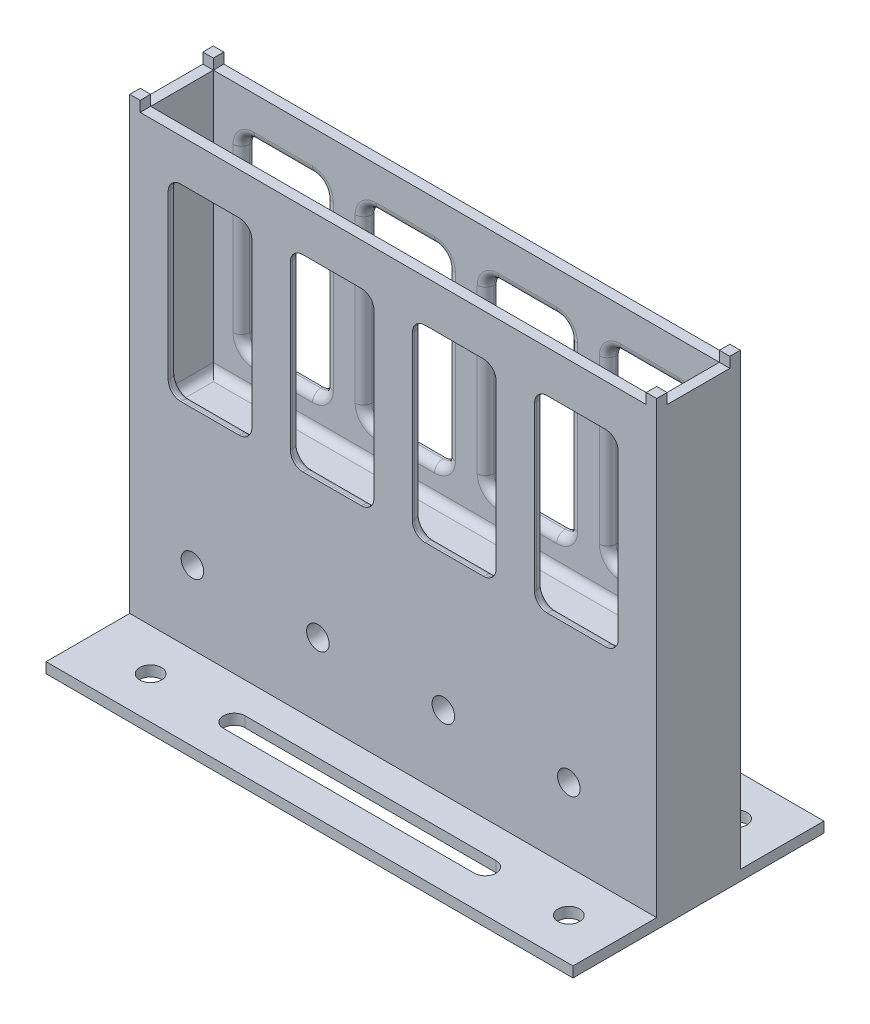
from build123d import *

# Parameters (mm, degrees)
SKETCH1_W               = 160.02
SKETCH1_H               = 25.4
BOSS_EXTRUDE1_DEPTH     = 82.55
SKETCH2_W               = 153.67
SKETCH2_H               = 19.05
CUT_EXTRUDE1_DEPTH      = 79.375
CUT_EXTRUDE2_DEPTH      = 118.733863438
SKETCH5_W               = 3.175
SKETCH5_H               = 3.175
BOSS_EXTRUDE2_DEPTH     = 3.175
SKETCH6_W               = 160.02
SKETCH6_H               = 25.4
BOSS_EXTRUDE3_DEPTH     = 50.8
SKETCH7_W               = 160.02
SKETCH7_H               = 76.2
BOSS_EXTRUDE4_DEPTH     = 3.175
SKETCH8_R               = 3.302
CUT_EXTRUDE3_DEPTH      = 163.764510029
FILLET1_R               = 2.54
CUT_EXTRUDE4_DEPTH      = 2.921
CUT_EXTRUDE5_DEPTH      = 124.296332975
CUT_EXTRUDE5_DEPTH_BACK = 124.296332975
SKETCH10_R              = 3.429
FILLET2_R               = 2.54


with BuildPart() as part:
    # Sketch1 → Boss-Extrude1 (new body)
    with BuildSketch(Plane(origin=(0, 0, 0), x_dir=(1, 0, 0), z_dir=(0, 1, 0))):
        Rectangle(SKETCH1_W, SKETCH1_H)
    extrude(amount=BOSS_EXTRUDE1_DEPTH)

    # Sketch2 → Cut-Extrude1 (cut)
    with BuildSketch(Plane(origin=(0, 82.55, 0), x_dir=(1, 0, 0), z_dir=(0, 1, 0))):
        Rectangle(SKETCH2_W, SKETCH2_H)
    extrude(amount=-CUT_EXTRUDE1_DEPTH, mode=Mode.SUBTRACT)

    # Sketch3 → Cut-Extrude2 (cut, through all)
    with BuildSketch(Plane.XY.offset(12.7)):
        with BuildLine():
            Line((-64.516, 69.85), (-46.736, 69.85))
            ThreePointArc((-46.736, 69.85), (-44.041923164, 68.734076836), (-42.926, 66.04))
            Line((-42.926, 66.04), (-42.926, 16.51))
            ThreePointArc((-42.926, 16.51), (-44.041923164, 13.815923164), (-46.736, 12.7))
            Line((-46.736, 12.7), (-64.516, 12.7))
            ThreePointArc((-64.516, 12.7), (-67.210076836, 13.815923164), (-68.326, 16.51))
            Line((-68.326, 16.51), (-68.326, 66.04))
            ThreePointArc((-68.326, 66.04), (-67.210076836, 68.734076836), (-64.516, 69.85))
        make_face()
        with BuildLine():
            Line((-27.432, 69.85), (-9.652, 69.85))
            ThreePointArc((-9.652, 69.85), (-6.957923164, 68.734076836), (-5.842, 66.04))
            Line((-5.842, 66.04), (-5.842, 16.51))
            ThreePointArc((-5.842, 16.51), (-6.957923164, 13.815923164), (-9.652, 12.7))
            Line((-9.652, 12.7), (-27.432, 12.7))
            ThreePointArc((-27.432, 12.7), (-30.126076836, 13.815923164), (-31.242, 16.51))
            Line((-31.242, 16.51), (-31.242, 66.04))
            ThreePointArc((-31.242, 66.04), (-30.126076836, 68.734076836), (-27.432, 69.85))
        make_face()
        with BuildLine():
            Line((9.652, 69.85), (27.432, 69.85))
            ThreePointArc((27.432, 69.85), (30.126076836, 68.734076836), (31.242, 66.04))
            Line((31.242, 66.04), (31.242, 16.51))
            ThreePointArc((31.242, 16.51), (30.126076836, 13.815923164), (27.432, 12.7))
            Line((27.432, 12.7), (9.652, 12.7))
            ThreePointArc((9.652, 12.7), (6.957923164, 13.815923164), (5.842, 16.51))
            Line((5.842, 16.51), (5.842, 66.04))
            ThreePointArc((5.842, 66.04), (6.957923164, 68.734076836), (9.652, 69.85))
        make_face()
        with BuildLine():
            Line((46.736, 69.85), (64.516, 69.85))
            ThreePointArc((64.516, 69.85), (67.210076836, 68.734076836), (68.326, 66.04))
            Line((68.326, 66.04), (68.326, 16.51))
            ThreePointArc((68.326, 16.51), (67.210076836, 13.815923164), (64.516, 12.7))
            Line((64.516, 12.7), (46.736, 12.7))
            ThreePointArc((46.736, 12.7), (44.041923164, 13.815923164), (42.926, 16.51))
            Line((42.926, 16.51), (42.926, 66.04))
            ThreePointArc((42.926, 66.04), (44.041923164, 68.734076836), (46.736, 69.85))
        make_face()
    extrude(amount=-CUT_EXTRUDE2_DEPTH, mode=Mode.SUBTRACT)

    # Sketch5 → Boss-Extrude2 (add)
    with BuildSketch(Plane(origin=(0, 82.55, 0), x_dir=(1, 0, 0), z_dir=(0, 1, 0))):
        with Locations((-78.4225, 11.1125)):
            Rectangle(SKETCH5_W, SKETCH5_H)
        with Locations((-78.4225, -11.1125)):
            Rectangle(SKETCH5_W, SKETCH5_H)
        with Locations((78.4225, -11.1125)):
            Rectangle(SKETCH5_W, SKETCH5_H)
        with Locations((78.4225, 11.1125)):
            Rectangle(SKETCH5_W, SKETCH5_H)
    extrude(amount=BOSS_EXTRUDE2_DEPTH)

    # Sketch6 → Boss-Extrude3 (add)
    with BuildSketch(Plane.XZ):
        Rectangle(SKETCH6_W, SKETCH6_H)
    extrude(amount=BOSS_EXTRUDE3_DEPTH)

    # Sketch7 → Boss-Extrude4 (add)
    with BuildSketch(Plane(origin=(0, -50.8, 0), x_dir=(-1, 0, 0), z_dir=(0, -1, 0))):
        Rectangle(SKETCH7_W, SKETCH7_H)
    extrude(amount=BOSS_EXTRUDE4_DEPTH)

    # Sketch8 → Cut-Extrude3 (cut, through all)
    with BuildSketch(Plane(origin=(0, -50.8, 0), x_dir=(1, 0, 0), z_dir=(0, 1, 0))):
        with Locations(Location((-60.96, 25.4, 0), (0, 0, 270))):
            Circle(SKETCH8_R)
        with Locations(Location((66.04, 25.4, 0), (0, 0, 270))):
            Circle(SKETCH8_R)
        with Locations(Location((66.04, -25.4, 0), (0, 0, 270))):
            Circle(SKETCH8_R)
        with Locations(Location((-60.96, -25.4, 0), (0, 0, 270))):
            Circle(SKETCH8_R)
        with BuildLine():
            Line((-35.56, 28.702), (40.64, 28.702))
            ThreePointArc((40.64, 28.702), (43.942, 25.4), (40.64, 22.098))
            Line((40.64, 22.098), (-35.56, 22.098))
            ThreePointArc((-35.56, 22.098), (-38.862, 25.4), (-35.56, 28.702))
        make_face()
        with BuildLine():
            Line((-35.56, -22.098), (40.64, -22.098))
            ThreePointArc((40.64, -22.098), (43.942, -25.4), (40.64, -28.702))
            Line((40.64, -28.702), (-35.56, -28.702))
            ThreePointArc((-35.56, -28.702), (-38.862, -25.4), (-35.56, -22.098))
        make_face()
    extrude(amount=-CUT_EXTRUDE3_DEPTH, mode=Mode.SUBTRACT)

    # Fillet1
    fillet1_edges = [part.edges().sort_by_distance(p)[0] for p in [
        (-6.957923164, 13.815923164, -9.525),
        (-18.542, 12.7, -9.525),
        (-30.126076836, 13.815923164, -9.525),
        (-31.242, 41.275, -9.525),
        (-30.126076836, 68.734076836, -9.525),
        (-18.542, 69.85, -9.525),
        (-6.957923164, 68.734076836, -9.525),
        (-5.842, 41.275, -9.525),
        (30.126076836, 13.815923164, -9.525),
        (18.542, 12.7, -9.525),
        (6.957923164, 13.815923164, -9.525),
        (5.842, 41.275, -9.525),
        (6.957923164, 68.734076836, -9.525),
        (18.542, 69.85, -9.525),
        (30.126076836, 68.734076836, -9.525),
        (31.242, 41.275, -9.525),
        (67.210076836, 13.815923164, -9.525),
        (55.626, 12.7, -9.525),
        (44.041923164, 13.815923164, -9.525),
        (42.926, 41.275, -9.525),
        (44.041923164, 68.734076836, -9.525),
        (55.626, 69.85, -9.525),
        (67.210076836, 68.734076836, -9.525),
        (68.326, 41.275, -9.525),
        (-42.926, 41.275, 9.525),
        (-44.041923164, 68.734076836, 9.525),
        (-55.626, 69.85, 9.525),
        (-67.210076836, 68.734076836, 9.525),
        (-68.326, 41.275, 9.525),
        (-67.210076836, 13.815923164, 9.525),
        (-55.626, 12.7, 9.525),
        (-44.041923164, 13.815923164, 9.525),
        (-44.041923164, 13.815923164, -9.525),
        (-55.626, 12.7, -9.525),
        (-67.210076836, 13.815923164, -9.525),
        (-68.326, 41.275, -9.525),
        (-67.210076836, 68.734076836, -9.525),
        (-55.626, 69.85, -9.525),
        (-44.041923164, 68.734076836, -9.525),
        (-42.926, 41.275, -9.525),
        (68.326, 41.275, 9.525),
        (67.210076836, 68.734076836, 9.525),
        (55.626, 69.85, 9.525),
        (44.041923164, 68.734076836, 9.525),
        (42.926, 41.275, 9.525),
        (44.041923164, 13.815923164, 9.525),
        (55.626, 12.7, 9.525),
        (67.210076836, 13.815923164, 9.525),
        (31.242, 41.275, 9.525),
        (30.126076836, 68.734076836, 9.525),
        (18.542, 69.85, 9.525),
        (6.957923164, 68.734076836, 9.525),
        (5.842, 41.275, 9.525),
        (6.957923164, 13.815923164, 9.525),
        (18.542, 12.7, 9.525),
        (30.126076836, 13.815923164, 9.525),
        (-5.842, 41.275, 9.525),
        (-6.957923164, 68.734076836, 9.525),
        (-18.542, 69.85, 9.525),
        (-30.126076836, 68.734076836, 9.525),
        (-31.242, 41.275, 9.525),
        (-30.126076836, 13.815923164, 9.525),
        (-18.542, 12.7, 9.525),
        (-6.957923164, 13.815923164, 9.525),
    ]]
    fillet(fillet1_edges, radius=FILLET1_R)

    # Sketch9 → Cut-Extrude4 (cut, symmetric)
    with BuildSketch(Plane.XY):
        Polygon((-66.421, -31.72790982), (-66.421, -65.540462496), (-55.499, -65.540462496), (-55.499, -31.72790982), (-55.499, -25.42209018), (-60.96, -22.26918036), (-66.421, -25.42209018), align=None)
        Polygon((-28.321, -65.540462496), (-17.399, -65.540462496), (-17.399, -31.72790982), (-17.399, -25.42209018), (-22.86, -22.26918036), (-28.321, -25.42209018), (-28.321, -31.72790982), align=None)
        Polygon((9.779, -65.540462496), (20.701, -65.540462496), (20.701, -31.72790982), (20.701, -25.42209018), (15.24, -22.26918036), (9.779, -25.42209018), (9.779, -31.72790982), align=None)
        Polygon((47.879, -65.540462496), (58.801, -65.540462496), (58.801, -31.72790982), (58.801, -25.42209018), (53.34, -22.26918036), (47.879, -25.42209018), (47.879, -31.72790982), align=None)
    extrude(amount=CUT_EXTRUDE4_DEPTH, both=True, mode=Mode.SUBTRACT)

    # Sketch10 → Cut-Extrude5 (cut, two sides: drawn at the far end of the back side and taken through both)
    with BuildSketch(Plane.XY.offset(-CUT_EXTRUDE5_DEPTH_BACK)):
        with Locations((-60.96, -28.575)):
            Circle(SKETCH10_R)
        with Locations((-22.86, -28.575)):
            Circle(SKETCH10_R)
        with Locations((15.24, -28.575)):
            Circle(SKETCH10_R)
        with Locations((53.34, -28.575)):
            Circle(SKETCH10_R)
    extrude(amount=CUT_EXTRUDE5_DEPTH + CUT_EXTRUDE5_DEPTH_BACK, mode=Mode.SUBTRACT)

    # Fillet2
    fillet2_edges = [part.edges().sort_by_distance(p)[0] for p in [
        (0, 3.175, -9.525),
        (-76.835, 3.175, 0),
        (0, 3.175, 9.525),
        (76.835, 3.175, 0),
    ]]
    fillet(fillet2_edges, radius=FILLET2_R)


solid = part.part
